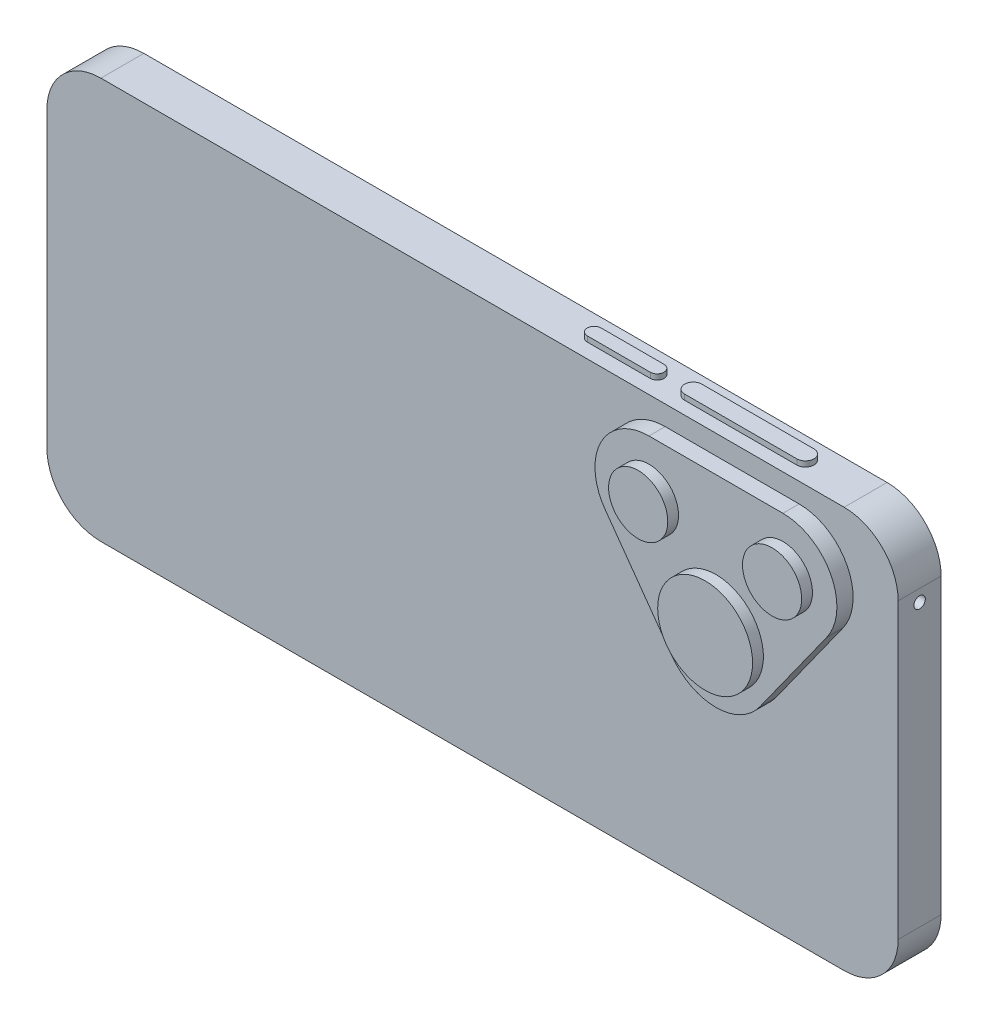
from build123d import *

# Parameters (mm, degrees)
EXTRUDE_1_DEPTH      = 7.95
SKETCH_3_OUTSIDE_W   = 194.484
SKETCH_3_OUTSIDE_H   = 111.184
CUT_EXTRUDE_11_DEPTH = 0.001
SKETCH_5_R           = 1.056956527
CUT_EXTRUDE_12_DEPTH = 5
EXTRUDE_2_DEPTH      = 1
CUT_EXTRUDE_13_DEPTH = 5
SKETCH_8_R           = 0.78636109
CUT_EXTRUDE_14_DEPTH = 5
SKETCH_11_R          = 0.458710636
CUT_EXTRUDE_15_DEPTH = 5
EXTRUDE_3_DEPTH      = 3
SKETCH_14_R          = 8.784302199
SKETCH_14_R_2        = 5.477679508
EXTRUDE_4_DEPTH      = 2


with BuildPart() as part:
    # 草图1 → 凸台-拉伸1 (new body)
    with BuildSketch(Plane.XY):
        with BuildLine():
            Line((-68.8, 37.15), (68.8, 37.15))
            ThreePointArc((68.8, 37.15), (75.871067812, 34.221067812), (78.8, 27.15))
            Line((78.8, 27.15), (78.8, -27.15))
            ThreePointArc((78.8, -27.15), (75.871067812, -34.221067812), (68.8, -37.15))
            Line((68.8, -37.15), (-68.8, -37.15))
            ThreePointArc((-68.8, -37.15), (-75.871067812, -34.221067812), (-78.8, -27.15))
            Line((-78.8, -27.15), (-78.8, 27.15))
            ThreePointArc((-78.8, 27.15), (-75.871067812, 34.221067812), (-68.8, 37.15))
        make_face()
    extrude(amount=EXTRUDE_1_DEPTH)

    # 草图3 outside → 切除-拉伸11 (cut)
    with BuildSketch(Plane(origin=(0, 0, 0), x_dir=(-1, 0, 0), z_dir=(0, 0, -1))):
        Rectangle(SKETCH_3_OUTSIDE_W, SKETCH_3_OUTSIDE_H)
        with BuildLine():
            Line((-68.8, -36.1), (68.8, -36.1))
            ThreePointArc((68.8, -36.1), (75.128605692, -33.478605692), (77.75, -27.15))
            Line((77.75, -27.15), (77.75, 27.15))
            ThreePointArc((77.75, 27.15), (75.128605692, 33.478605692), (68.8, 36.1))
            Line((68.8, 36.1), (-68.8, 36.1))
            ThreePointArc((-68.8, 36.1), (-75.128605692, 33.478605692), (-77.75, 27.15))
            Line((-77.75, 27.15), (-77.75, -27.15))
            ThreePointArc((-77.75, -27.15), (-75.128605692, -33.478605692), (-68.8, -36.1))
        make_face(mode=Mode.SUBTRACT)
    extrude(amount=-CUT_EXTRUDE_11_DEPTH, mode=Mode.SUBTRACT)

    # 草图5 → 切除-拉伸12 (cut)
    with BuildSketch(Plane(origin=(78.8, 0, 0), x_dir=(0, 0, -1), z_dir=(1, 0, 0))):
        with Locations(Location((-3.9755, 24.926367293, 0), (0, 0, 90))):
            Circle(SKETCH_5_R)
    extrude(amount=-CUT_EXTRUDE_12_DEPTH, mode=Mode.SUBTRACT)

    # 草图6 → 凸台-拉伸2 (add)
    with BuildSketch(Plane(origin=(0, 37.15, 0), x_dir=(1, 0, 0), z_dir=(0, 1, 0))):
        with BuildLine():
            Line((36.881407925, -2.384573788), (57.653695148, -2.384573788))
            ThreePointArc((57.653695148, -2.384573788), (59.24462136, -3.9755), (57.653695148, -5.566426212))
            Line((57.653695148, -5.566426212), (36.881407925, -5.566426212))
            ThreePointArc((36.881407925, -5.566426212), (35.290481714, -3.9755), (36.881407925, -2.384573788))
        make_face()
        with BuildLine():
            Line((30.204601318, -5.24848304), (18.54668502, -5.24848304))
            ThreePointArc((18.54668502, -5.24848304), (17.27370198, -3.9755), (18.54668502, -2.70251696))
            Line((18.54668502, -2.70251696), (30.204601318, -2.70251696))
            ThreePointArc((30.204601318, -2.70251696), (31.477584358, -3.9755), (30.204601318, -5.24848304))
        make_face()
    extrude(amount=EXTRUDE_2_DEPTH)

    # 草图7 → 切除-拉伸13 (cut)
    with BuildSketch(Plane.ZY.offset(78.8)):
        with BuildLine():
            Line((3.210974453, -3.219498771), (3.210974453, 3.219498771))
            ThreePointArc((3.210974453, 3.219498771), (3.9755, 3.984024318), (4.740025547, 3.219498771))
            Line((4.740025547, 3.219498771), (4.740025547, -3.219498771))
            ThreePointArc((4.740025547, -3.219498771), (3.9755, -3.984024318), (3.210974453, -3.219498771))
        make_face()
    extrude(amount=-CUT_EXTRUDE_13_DEPTH, mode=Mode.SUBTRACT)

    # 草图8 → 切除-拉伸14 (cut)
    with BuildSketch(Plane.ZY.offset(78.8)):
        with Locations(Location((3.9755, 25.237609302, 0), (0, 0, 270))):
            Circle(SKETCH_8_R)
        with Locations(Location((3.9755, 22.616405668, 0), (0, 0, 270))):
            Circle(SKETCH_8_R)
        with Locations(Location((3.9755, 19.995202033, 0), (0, 0, 270))):
            Circle(SKETCH_8_R)
        with Locations(Location((3.9755, 17.570588671, 0), (0, 0, 270))):
            Circle(SKETCH_8_R)
        with Locations(Location((3.9755, 15.145975309, 0), (0, 0, 270))):
            Circle(SKETCH_8_R)
        with Locations(Location((3.9755, 12.590301765, 0), (0, 0, 270))):
            Circle(SKETCH_8_R)
    extrude(amount=-CUT_EXTRUDE_14_DEPTH, mode=Mode.SUBTRACT)

    # 草图11 → 切除-拉伸15 (cut)
    with BuildSketch(Plane.ZY.offset(78.8)):
        with Locations(Location((3.9755, -25.155030575, 0), (0, 0, 270))):
            Circle(SKETCH_11_R)
    extrude(amount=-CUT_EXTRUDE_15_DEPTH, mode=Mode.SUBTRACT)

    # 草图13 → 凸台-拉伸3 (add)
    with BuildSketch(Plane.XY.offset(7.95)):
        with BuildLine():
            Line((35.665823079, 33.513099336), (60.458995853, 33.513099336))
            ThreePointArc((60.458995853, 33.513099336), (69.352474106, 28.08541216), (68.591748787, 17.694308248))
            Line((68.591748787, 17.694308248), (56.1951624, 0.367964546))
            ThreePointArc((56.1951624, 0.367964546), (48.062409466, -3.813244367), (39.929656532, 0.367964546))
            Line((39.929656532, 0.367964546), (27.533070145, 17.694308248))
            ThreePointArc((27.533070145, 17.694308248), (26.772344826, 28.08541216), (35.665823079, 33.513099336))
        make_face()
    extrude(amount=EXTRUDE_3_DEPTH)

    # 草图14 → 凸台-拉伸4 (add)
    with BuildSketch(Plane.XY.offset(10.95)):
        with Locations(Location((48.062409466, 8.713531937, 0), (0, 0, 180))):
            Circle(SKETCH_14_R)
        with Locations(Location((35.665823079, 23.513099336, 0), (0, 0, 180))):
            Circle(SKETCH_14_R_2)
        with Locations(Location((60.458995853, 23.513099336, 0), (0, 0, 180))):
            Circle(SKETCH_14_R_2)
    extrude(amount=EXTRUDE_4_DEPTH)


solid = part.part
